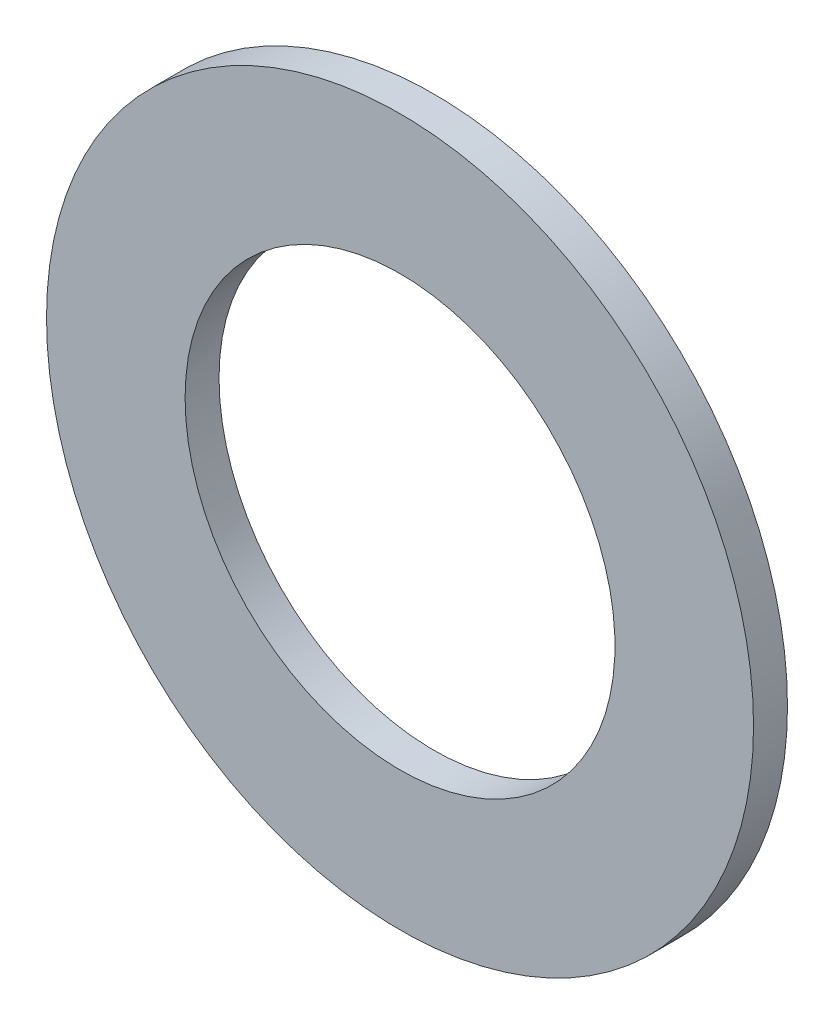
from build123d import *

# Parameters (mm, degrees)
SKETCH1_R           = 15.875
SKETCH1_R_2         = 9.652
BOSS_EXTRUDE1_DEPTH = 1.524


with BuildPart() as part:
    # Sketch1 → Boss-Extrude1 (new body)
    with BuildSketch(Plane.XY):
        Circle(SKETCH1_R)
        Circle(SKETCH1_R_2, mode=Mode.SUBTRACT)
    extrude(amount=BOSS_EXTRUDE1_DEPTH)


solid = part.part
